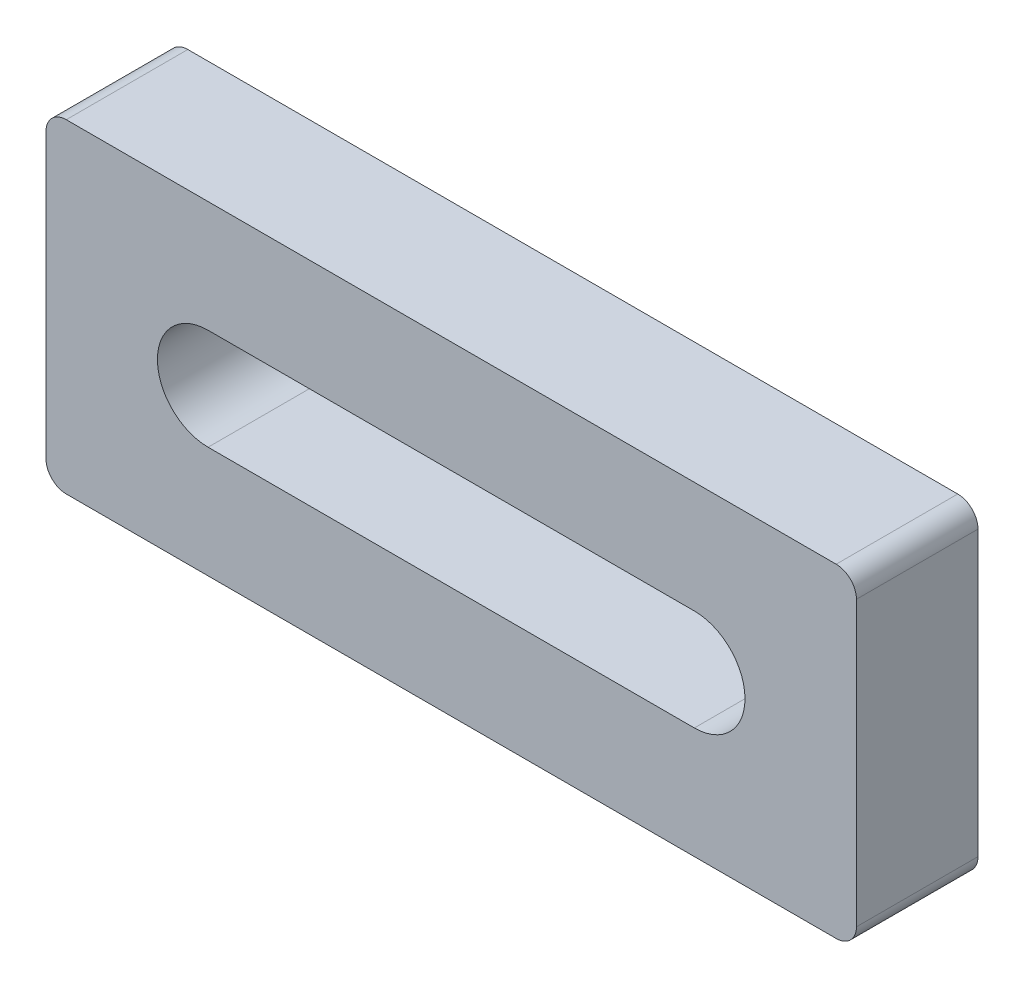
from build123d import *

# Parameters (mm, degrees)
BASE_EXTRUDE_DEPTH = 19.05


with BuildPart() as part:
    # Sketch1 → Base-Extrude (new body)
    with BuildSketch(Plane.XY):
        with BuildLine():
            Line((-76.2, -6.35), (-196.85, -6.35))
            ThreePointArc((-196.85, -6.35), (-199.09506403, -5.42006403), (-200.025, -3.175))
            Line((-200.025, -3.175), (-200.025, 41.275))
            ThreePointArc((-200.025, 41.275), (-199.09506403, 43.52006403), (-196.85, 44.45))
            Line((-196.85, 44.45), (-76.2, 44.45))
            ThreePointArc((-76.2, 44.45), (-73.95493597, 43.52006403), (-73.025, 41.275))
            Line((-73.025, 41.275), (-73.025, -3.175))
            ThreePointArc((-73.025, -3.175), (-73.95493597, -5.42006403), (-76.2, -6.35))
        make_face()
        with BuildLine():
            Line((-174.625, 11.1125), (-98.425, 11.1125))
            ThreePointArc((-98.425, 11.1125), (-90.4875, 19.05), (-98.425, 26.9875))
            Line((-98.425, 26.9875), (-174.625, 26.9875))
            ThreePointArc((-174.625, 26.9875), (-182.5625, 19.05), (-174.625, 11.1125))
        make_face(mode=Mode.SUBTRACT)
    extrude(amount=BASE_EXTRUDE_DEPTH)


solid = part.part
